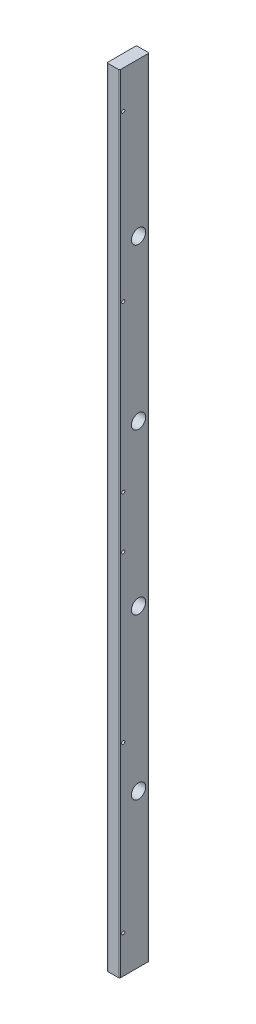
from build123d import *

# Parameters (mm, degrees)
SKETCH1_W           = 38.1
SKETCH1_H           = 88.9
BOSS_EXTRUDE1_DEPTH = 2362.2
SKETCH2_R           = 21.43125
CUT_EXTRUDE4_DEPTH  = 918.6545
SKETCH3_R           = 4.7625
CUT_EXTRUDE5_DEPTH  = 2363.925359062
FILLET1_R           = 3.175


with BuildPart() as part:
    # Sketch1 → Boss-Extrude1 (new body)
    with BuildSketch(Plane(origin=(0, 0, 0), x_dir=(1, 0, 0), z_dir=(0, 1, 0))):
        Rectangle(SKETCH1_W, SKETCH1_H)
    extrude(amount=BOSS_EXTRUDE1_DEPTH)

    # Sketch2 → Cut-Extrude4 (cut)
    with BuildSketch(Plane(origin=(19.05, 0, 0), x_dir=(0, 0, -1), z_dir=(1, 0, 0))):
        with Locations((12.7, 458.7875)):
            Circle(SKETCH2_R)
        with Locations((12.7, 939.8)):
            Circle(SKETCH2_R)
        with Locations((12.7, 1420.84425)):
            Circle(SKETCH2_R)
        with Locations((12.7, 1901.8885)):
            Circle(SKETCH2_R)
    extrude(amount=-CUT_EXTRUDE4_DEPTH, mode=Mode.SUBTRACT)

    # Sketch3 → Cut-Extrude5 (cut, through all)
    with BuildSketch(Plane(origin=(19.05, 0, 0), x_dir=(0, 0, -1), z_dir=(1, 0, 0))):
        with Locations((-33.3375, 112.7125)):
            Circle(SKETCH3_R)
        with Locations((-33.3375, 608.0125)):
            Circle(SKETCH3_R)
        with Locations((-33.3375, 1103.3125)):
            Circle(SKETCH3_R)
    cut_extrude5 = extrude(amount=-CUT_EXTRUDE5_DEPTH, mode=Mode.SUBTRACT)

    # Fillet1
    fillet1_edges = [part.edges().sort_by_distance(p)[0] for p in [
        (19.05, 1181.1, 44.45),
        (-19.05, 1181.1, 44.45),
        (-19.05, 1181.1, -44.45),
        (19.05, 1181.1, -44.45),
    ]]
    fillet(fillet1_edges, radius=FILLET1_R)

    # Mirror1: Cut-Extrude5 across plane
    add(cut_extrude5.mirror(Plane.ZX.offset(1181.1)), mode=Mode.SUBTRACT)


solid = part.part
